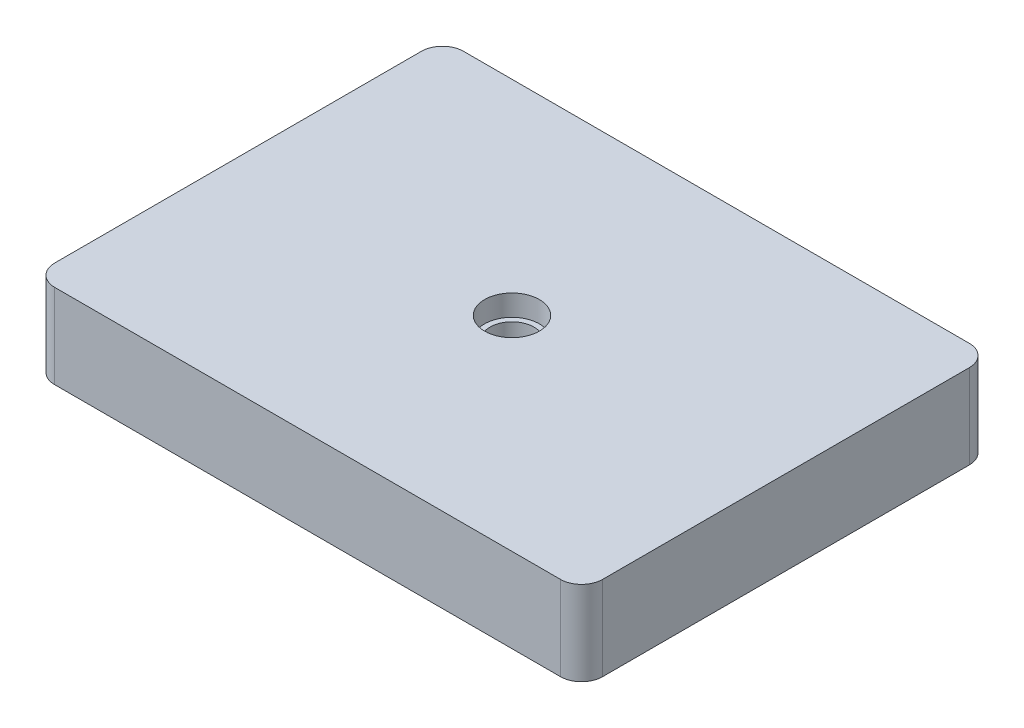
from build123d import *

# Parameters (mm, degrees)
SKETCH1_W           = 130
SKETCH1_H           = 97
BOSS_EXTRUDE1_DEPTH = 20
SKETCH2_R           = 5.2
CUT_EXTRUDE1_DEPTH  = 84.529934754
SKETCH3_R           = 6.5
CUT_EXTRUDE2_DEPTH  = 5
FILLET1_R           = 5


with BuildPart() as part:
    # Sketch1 → Boss-Extrude1 (new body)
    with BuildSketch(Plane(origin=(0, 0, 0), x_dir=(1, 0, 0), z_dir=(0, 1, 0))):
        Rectangle(SKETCH1_W, SKETCH1_H)
    extrude(amount=-BOSS_EXTRUDE1_DEPTH)

    # Sketch2 → Cut-Extrude1 (cut, through all)
    with BuildSketch(Plane(origin=(0, 0, 0), x_dir=(1, 0, 0), z_dir=(0, 1, 0))):
        with Locations(Location((0, 0, 0), (0, 0, 270))):
            Circle(SKETCH2_R)
    extrude(amount=-CUT_EXTRUDE1_DEPTH, mode=Mode.SUBTRACT)

    # Sketch3 → Cut-Extrude2 (cut)
    with BuildSketch(Plane(origin=(0, 0, 0), x_dir=(1, 0, 0), z_dir=(0, 1, 0))):
        with Locations(Location((0, 0, 0), (0, 0, 270))):
            Circle(SKETCH3_R)
    extrude(amount=-CUT_EXTRUDE2_DEPTH, mode=Mode.SUBTRACT)

    # Fillet1
    fillet1_edges = [part.edges().sort_by_distance(p)[0] for p in [
        (65, -10, 48.5),
        (-65, -10, 48.5),
        (-65, -10, -48.5),
        (65, -10, -48.5),
    ]]
    fillet(fillet1_edges, radius=FILLET1_R)


solid = part.part
